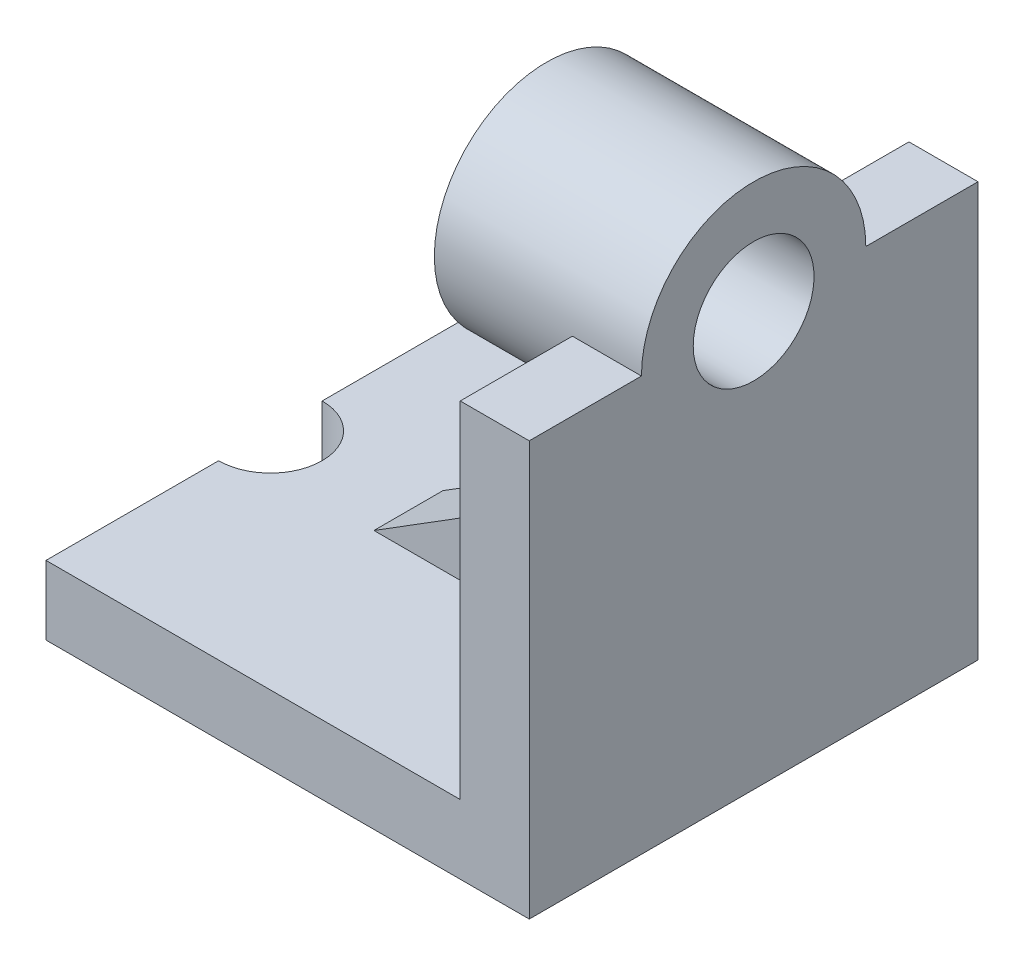
from build123d import *

# Parameters (mm, degrees)
SKETCH_1_W          = 140
SKETCH_1_H          = 20
SKETCH_1_W_2        = 20
SKETCH_1_H_2        = 100
EXTRUDE_1_DEPTH     = 65
SKETCH_5_R          = 32.5
EXTRUDE_3_DEPTH     = 60
SKETCH_6_R          = 17.5
CUT_EXTRUDE_1_DEPTH = 176.87282337
SKETCH_7_R          = 15
CUT_EXTRUDE_2_DEPTH = 164.343962239
RIB_1_REACH         = 173.555
SKETCH_8_WALL_W     = 439.450580606
SKETCH_8_WALL_H     = 20


with BuildPart() as part:
    # Эскиз1 → Бобышка-Вытянуть1 (new, symmetric)
    with BuildSketch(Plane.XY):
        Rectangle(SKETCH_1_W, SKETCH_1_H)
        with Locations((60, 60)):
            Rectangle(SKETCH_1_W_2, SKETCH_1_H_2)
    extrude(amount=EXTRUDE_1_DEPTH, both=True)

    # Эскиз5 → Бобышка-Вытянуть3 (add)
    with BuildSketch(Plane(origin=(70, 0, 0), x_dir=(0, 0, -1), z_dir=(1, 0, 0))):
        with Locations((0, 110)):
            Circle(SKETCH_5_R)
    extrude(amount=-EXTRUDE_3_DEPTH)

    # Эскиз6 → Вырез-Вытянуть1 (cut, through all)
    with BuildSketch(Plane.ZY.offset(-10)):
        with Locations((0, 110)):
            Circle(SKETCH_6_R)
    extrude(amount=-CUT_EXTRUDE_1_DEPTH, mode=Mode.SUBTRACT)

    # Эскиз7 → Вырез-Вытянуть2 (cut, through all)
    with BuildSketch(Plane(origin=(0, 10, 0), x_dir=(1, 0, 0), z_dir=(0, 1, 0))):
        with Locations((-70, 0)):
            Circle(SKETCH_7_R)
    extrude(amount=-CUT_EXTRUDE_2_DEPTH, mode=Mode.SUBTRACT)

    # Эскиз8 wall → Ребро1 (add, up to next)
    with BuildSketch(Plane(origin=(10, 35, 0), x_dir=(0.847998304005, 0.529998940003, 0), z_dir=(-0.529998940003, 0.847998304005, 0)), mode=Mode.PRIVATE) as rib_1_sk1:
        Rectangle(SKETCH_8_WALL_W, SKETCH_8_WALL_H)
    rib_1_tool1 = extrude(rib_1_sk1.sketch, amount=-RIB_1_REACH, mode=Mode.PRIVATE) - part.part
    add(rib_1_tool1.solids().sort_by_distance((10, 35, 0))[0])


solid = part.part
